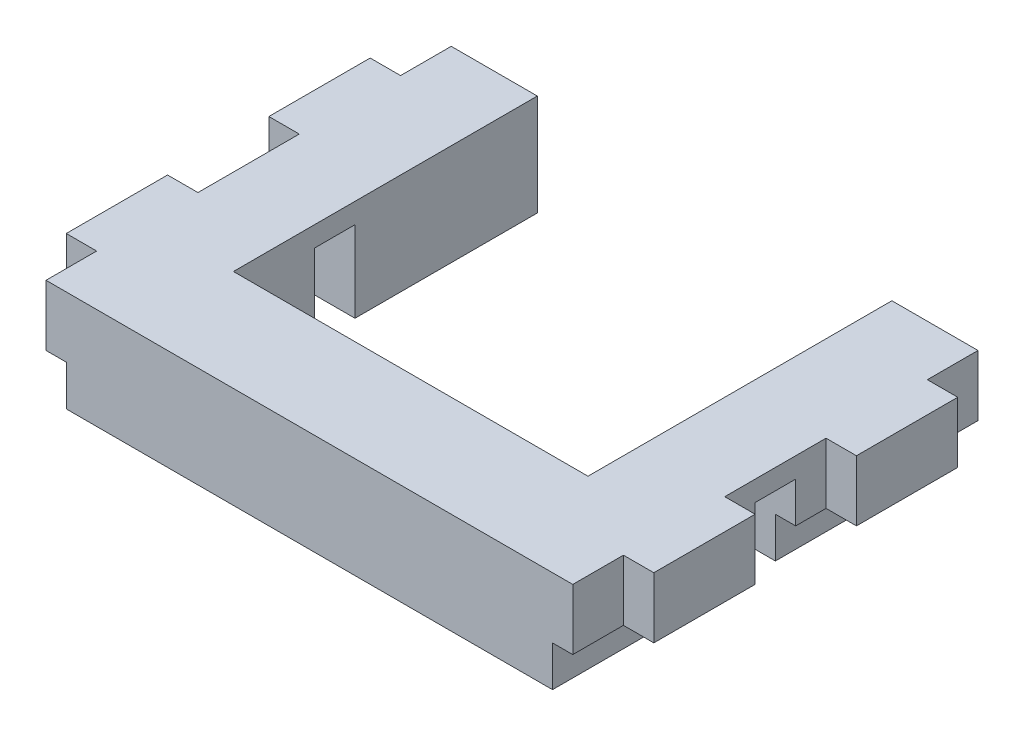
from build123d import *

# Parameters (mm, degrees)
BOSS_EXTRUDE1_DEPTH = 40
SKETCH2_W           = 35
SKETCH2_H           = 30
SKETCH2_W_2         = 3
SKETCH2_H_2         = 10
SKETCH2_H_3         = 5
CUT_EXTRUDE1_DEPTH  = 51.408332645
SKETCH3_W           = 58
SKETCH3_H           = 4
CUT_EXTRUDE2_DEPTH  = 8


with BuildPart() as part:
    # Sketch1 → Boss-Extrude1 (new body)
    with BuildSketch(Plane.XY):
        Polygon((24, -3), (29, -3), (29, 3), (-29, 3), (-29, -3), (-24, -3), (-24, -7), (24, -7), align=None)
    extrude(amount=BOSS_EXTRUDE1_DEPTH)

    # Sketch2 → Cut-Extrude1 (cut, through all)
    with BuildSketch(Plane(origin=(0, 3, 0), x_dir=(1, 0, 0), z_dir=(0, 1, 0))):
        with Locations((0, -15)):
            Rectangle(SKETCH2_W, SKETCH2_H)
        with Locations((27.5, -20)):
            Rectangle(SKETCH2_W_2, SKETCH2_H_2)
        with Locations((-27.5, -20)):
            Rectangle(SKETCH2_W_2, SKETCH2_H_2)
        with Locations((27.5, -37.5)):
            Rectangle(SKETCH2_W_2, SKETCH2_H_3)
        with Locations((-27.5, -37.5)):
            Rectangle(SKETCH2_W_2, SKETCH2_H_3)
        with Locations((-82.5, -20)):
            Rectangle(SKETCH2_W_2, SKETCH2_H_2)
        with Locations((27.5, 0)):
            Rectangle(SKETCH2_W_2, SKETCH2_H_2)
        with Locations((-27.5, 0)):
            Rectangle(SKETCH2_W_2, SKETCH2_H_2)
        with Locations((-82.5, 0)):
            Rectangle(SKETCH2_W_2, SKETCH2_H_2)
    extrude(amount=-CUT_EXTRUDE1_DEPTH, mode=Mode.SUBTRACT)

    # Sketch3 → Cut-Extrude2 (cut)
    with BuildSketch(Plane.XZ.offset(7)):
        with Locations((0, 20)):
            Rectangle(SKETCH3_W, SKETCH3_H)
    extrude(amount=-CUT_EXTRUDE2_DEPTH, mode=Mode.SUBTRACT)


solid = part.part
